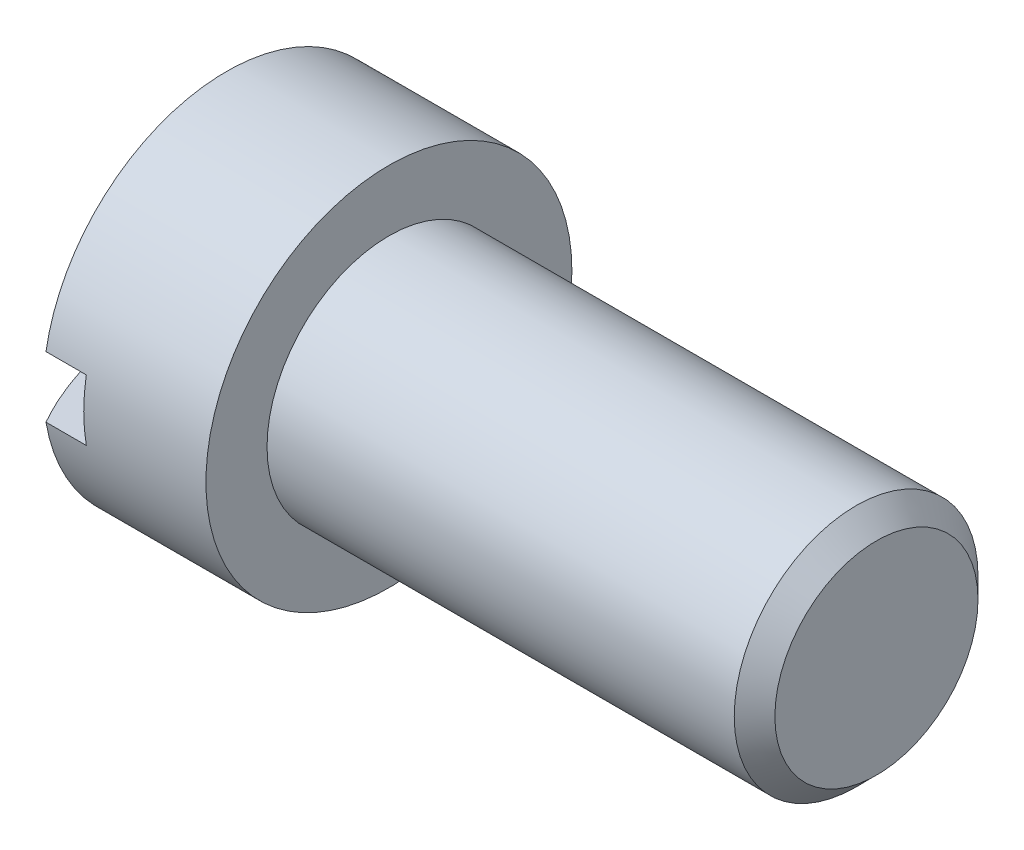
from build123d import *

# Parameters (mm, degrees)
CUT_EXTRUDE1_DEPTH      = 22.567344827
CUT_EXTRUDE1_DEPTH_BACK = 22.567344827
SKETCH2_W               = 3.175
SKETCH2_H               = 2.3876
CHAMFER1_SIZE           = 0.79375


with BuildPart() as part:
    # Sketch1 → Revolve1 (revolve)
    with BuildSketch(Plane.XY, mode=Mode.PRIVATE) as revolve1_sk:
        with BuildLine():
            Line((-4.7752, 0), (19.05, 0))
            Line((19.05, 0), (19.05, 4.7625))
            Line((19.05, 4.7625), (0, 4.7625))
            Line((0, 4.7625), (0, 7.1501))
            Line((0, 7.1501), (-6.35, 7.1501))
            ThreePointArc((-6.35, 7.1501), (-7.543180771, 4.277553789), (-7.9502, 1.1938))
            Line((-7.9502, 1.1938), (-4.7752, 1.1938))
            Line((-4.7752, 1.1938), (-4.7752, 0))
        make_face()
    revolve(revolve1_sk.sketch.rotate(Axis((25.63827619, 0, 0), (-1, 0, 0)), 90), axis=Axis((25.63827619, 0, 0), (-1, 0, 0)))

    # Sketch2 → Cut-Extrude1 (cut, two sides: drawn at the far end of the back side and taken through both)
    with BuildSketch(Plane.XY.offset(-CUT_EXTRUDE1_DEPTH_BACK)):
        with Locations((-6.3627, 0)):
            Rectangle(SKETCH2_W, SKETCH2_H)
    extrude(amount=CUT_EXTRUDE1_DEPTH + CUT_EXTRUDE1_DEPTH_BACK, mode=Mode.SUBTRACT)

    # Chamfer1
    chamfer1_edges = [part.edges().sort_by_distance(p)[0] for p in [
        (19.05, 0, 4.7625),
    ]]
    chamfer(chamfer1_edges, length=CHAMFER1_SIZE)


solid = part.part
